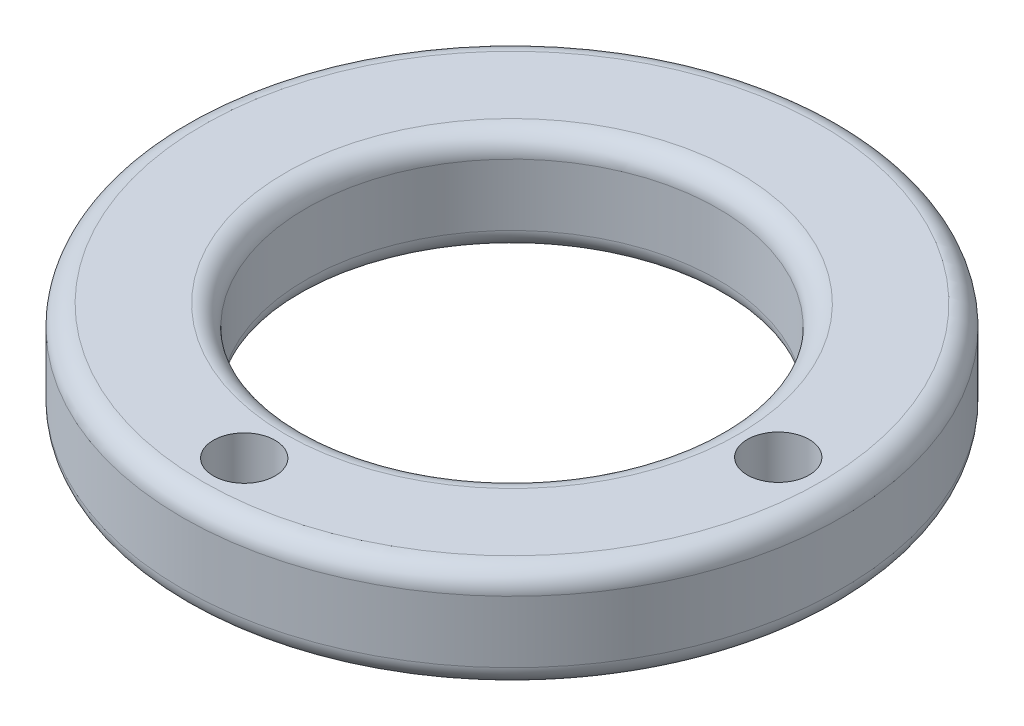
from build123d import *

# Parameters (mm, degrees)
SKETCH1_R           = 16
SKETCH1_R_2         = 10
SKETCH1_R_3         = 1.5
BOSS_EXTRUDE1_DEPTH = 5
FILLET1_R           = 1


with BuildPart() as part:
    # Sketch1 → Boss-Extrude1 (new body)
    with BuildSketch(Plane(origin=(0, 0, 0), x_dir=(1, 0, 0), z_dir=(0, 1, 0))):
        with Locations(Location((0, 0, 0), (0, 0, 270))):
            Circle(SKETCH1_R)
        with Locations(Location((0, 0, 0), (0, 0, 270))):
            Circle(SKETCH1_R_2, mode=Mode.SUBTRACT)
        with Locations(Location((0, -13, 0), (0, 0, 270))):
            Circle(SKETCH1_R_3, mode=Mode.SUBTRACT)
        with Locations(Location((12.925776556, 0, 0), (0, 0, 270))):
            Circle(SKETCH1_R_3, mode=Mode.SUBTRACT)
    extrude(amount=BOSS_EXTRUDE1_DEPTH)

    # Fillet1
    fillet1_edges = [part.edges().sort_by_distance(p)[0] for p in [
        (0, 0, -16),
        (0, 5, -16),
        (0, 0, -10),
        (0, 5, -10),
    ]]
    fillet(fillet1_edges, radius=FILLET1_R)


solid = part.part
